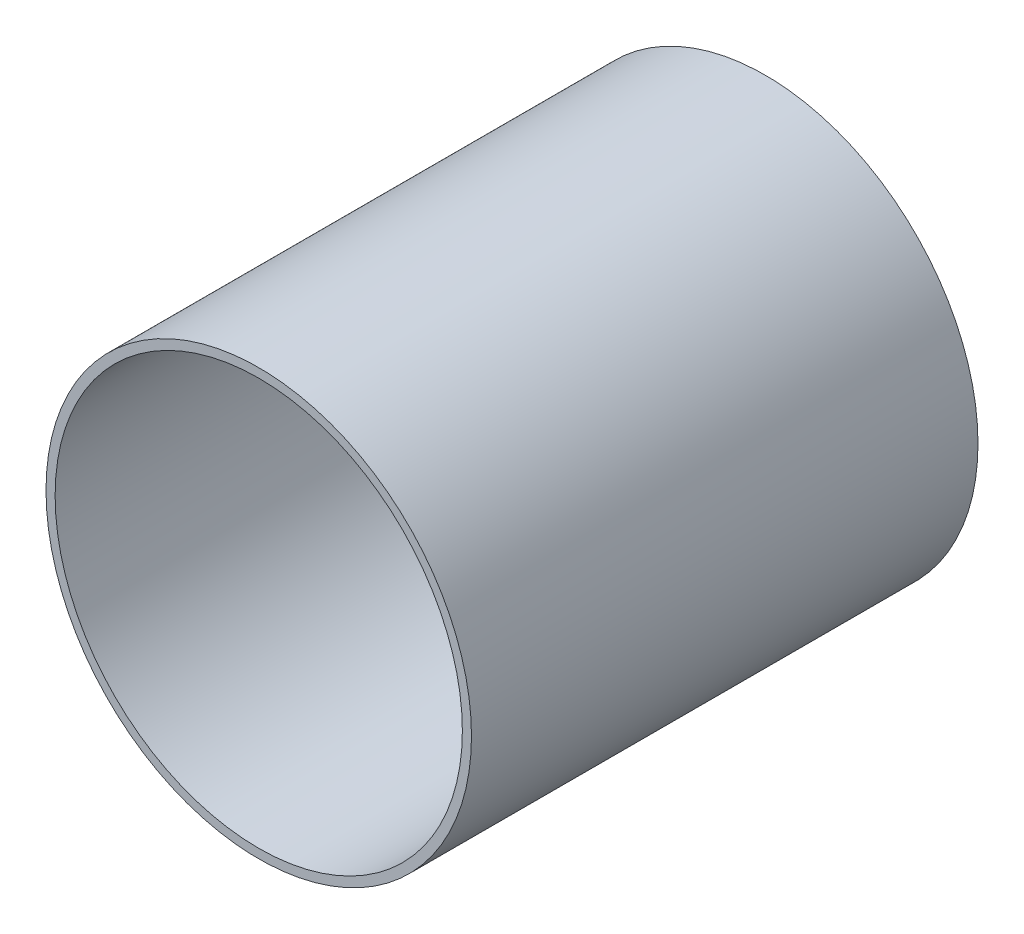
from build123d import *

# Parameters (mm, degrees)
SKETCH1_R           = 10.5
SKETCH1_R_2         = 10.05
BOSS_EXTRUDE1_DEPTH = 25


with BuildPart() as part:
    # Sketch1 → Boss-Extrude1 (new body)
    with BuildSketch(Plane.XY):
        Circle(SKETCH1_R)
        Circle(SKETCH1_R_2, mode=Mode.SUBTRACT)
    extrude(amount=BOSS_EXTRUDE1_DEPTH)


solid = part.part
